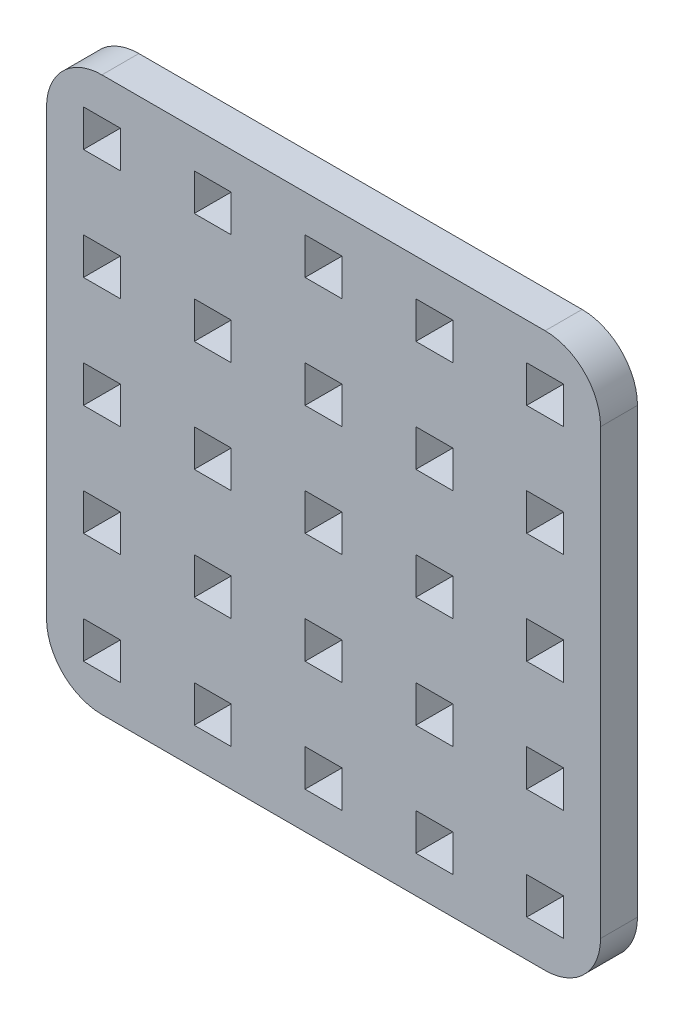
from build123d import *

# Parameters (mm, degrees)
MODEL_W                 = 3
MODEL_H                 = 3
SALIENTE_EXTRUIR1_DEPTH = 3


with BuildPart() as part:
    # Model → Saliente-Extruir1 (new body)
    with BuildSketch(Plane.XY):
        with BuildLine():
            Line((16.117442786, 300.002712349), (52.117442786, 300.002712349))
            ThreePointArc((52.117442786, 300.002712349), (55.299423301, 298.684692865), (56.617442786, 295.502712349))
            Line((56.617442786, 295.502712349), (56.617442786, 259.502712349))
            ThreePointArc((56.617442786, 259.502712349), (55.299423301, 256.320731834), (52.117442786, 255.002712349))
            Line((52.117442786, 255.002712349), (16.117442786, 255.002712349))
            ThreePointArc((16.117442786, 255.002712349), (12.935462271, 256.320731834), (11.617442786, 259.502712349))
            Line((11.617442786, 259.502712349), (11.617442786, 295.502712349))
            ThreePointArc((11.617442786, 295.502712349), (12.935462271, 298.684692865), (16.117442786, 300.002712349))
        make_face()
        with Locations((16.117442786, 295.502712349)):
            Rectangle(MODEL_W, MODEL_H, mode=Mode.SUBTRACT)
        with Locations((25.117442786, 295.502712349)):
            Rectangle(MODEL_W, MODEL_H, mode=Mode.SUBTRACT)
        with Locations((34.117442786, 295.502712349)):
            Rectangle(MODEL_W, MODEL_H, mode=Mode.SUBTRACT)
        with Locations((43.117442786, 295.502712349)):
            Rectangle(MODEL_W, MODEL_H, mode=Mode.SUBTRACT)
        with Locations((52.117442786, 295.502712349)):
            Rectangle(MODEL_W, MODEL_H, mode=Mode.SUBTRACT)
        with Locations((16.117442786, 259.502712349)):
            Rectangle(MODEL_W, MODEL_H, mode=Mode.SUBTRACT)
        with Locations((25.117442786, 259.502712349)):
            Rectangle(MODEL_W, MODEL_H, mode=Mode.SUBTRACT)
        with Locations((34.117442786, 259.502712349)):
            Rectangle(MODEL_W, MODEL_H, mode=Mode.SUBTRACT)
        with Locations((43.117442786, 259.502712349)):
            Rectangle(MODEL_W, MODEL_H, mode=Mode.SUBTRACT)
        with Locations((52.117442786, 259.502712349)):
            Rectangle(MODEL_W, MODEL_H, mode=Mode.SUBTRACT)
        with Locations((16.117442786, 286.502712349)):
            Rectangle(MODEL_W, MODEL_H, mode=Mode.SUBTRACT)
        with Locations((25.117442786, 286.502712349)):
            Rectangle(MODEL_W, MODEL_H, mode=Mode.SUBTRACT)
        with Locations((34.117442786, 286.502712349)):
            Rectangle(MODEL_W, MODEL_H, mode=Mode.SUBTRACT)
        with Locations((43.117442786, 286.502712349)):
            Rectangle(MODEL_W, MODEL_H, mode=Mode.SUBTRACT)
        with Locations((52.117442786, 286.502712349)):
            Rectangle(MODEL_W, MODEL_H, mode=Mode.SUBTRACT)
        with Locations((16.117442786, 277.502712349)):
            Rectangle(MODEL_W, MODEL_H, mode=Mode.SUBTRACT)
        with Locations((25.117442786, 277.502712349)):
            Rectangle(MODEL_W, MODEL_H, mode=Mode.SUBTRACT)
        with Locations((34.117442786, 277.502712349)):
            Rectangle(MODEL_W, MODEL_H, mode=Mode.SUBTRACT)
        with Locations((43.117442786, 277.502712349)):
            Rectangle(MODEL_W, MODEL_H, mode=Mode.SUBTRACT)
        with Locations((52.117442786, 277.502712349)):
            Rectangle(MODEL_W, MODEL_H, mode=Mode.SUBTRACT)
        with Locations((16.117442786, 268.502712349)):
            Rectangle(MODEL_W, MODEL_H, mode=Mode.SUBTRACT)
        with Locations((25.117442786, 268.502712349)):
            Rectangle(MODEL_W, MODEL_H, mode=Mode.SUBTRACT)
        with Locations((34.117442786, 268.502712349)):
            Rectangle(MODEL_W, MODEL_H, mode=Mode.SUBTRACT)
        with Locations((43.117442786, 268.502712349)):
            Rectangle(MODEL_W, MODEL_H, mode=Mode.SUBTRACT)
        with Locations((52.117442786, 268.502712349)):
            Rectangle(MODEL_W, MODEL_H, mode=Mode.SUBTRACT)
    extrude(amount=SALIENTE_EXTRUIR1_DEPTH)


solid = part.part
